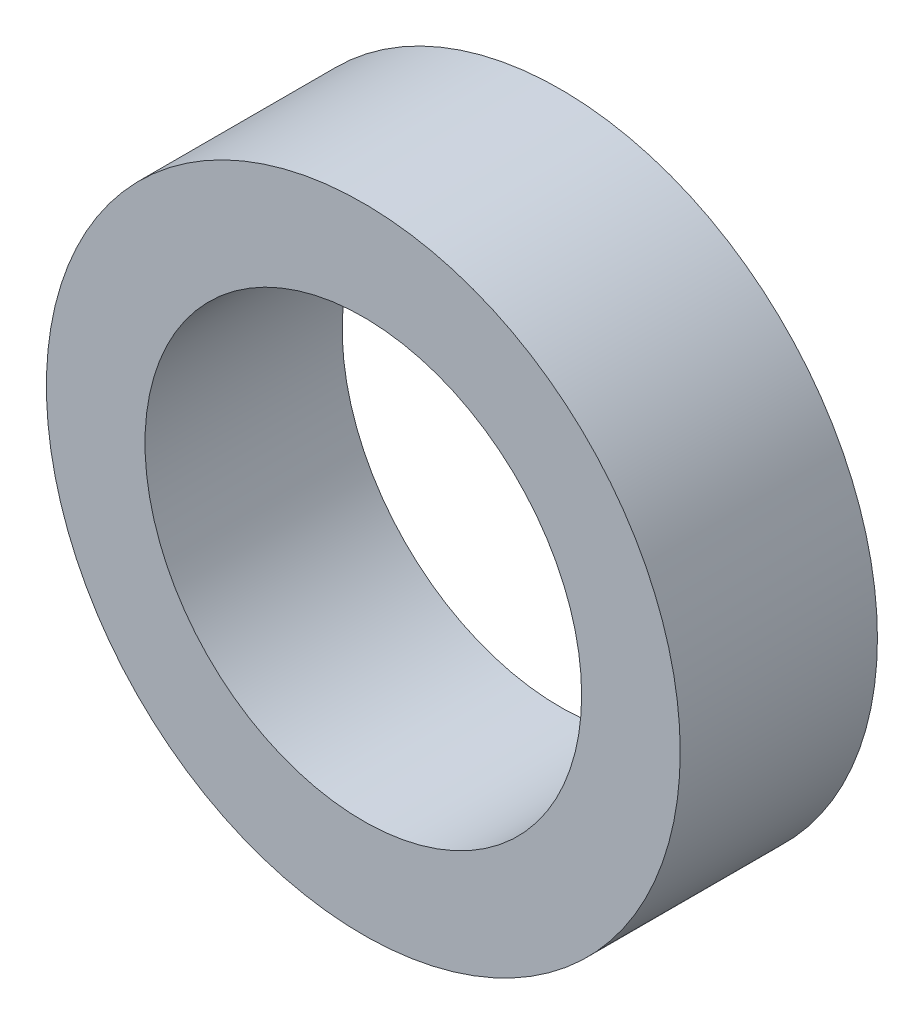
from build123d import *

# Parameters (mm, degrees)
SKETCH_1_R      = 4.5
SKETCH_1_R_2    = 3.1
EXTRUDE_1_DEPTH = 2.8


with BuildPart() as part:
    # ｽｹｯﾁ1 → ﾎﾞｽ - 押し出し1 (new body)
    with BuildSketch(Plane.XY):
        Circle(SKETCH_1_R)
        Circle(SKETCH_1_R_2, mode=Mode.SUBTRACT)
    extrude(amount=EXTRUDE_1_DEPTH)


solid = part.part
